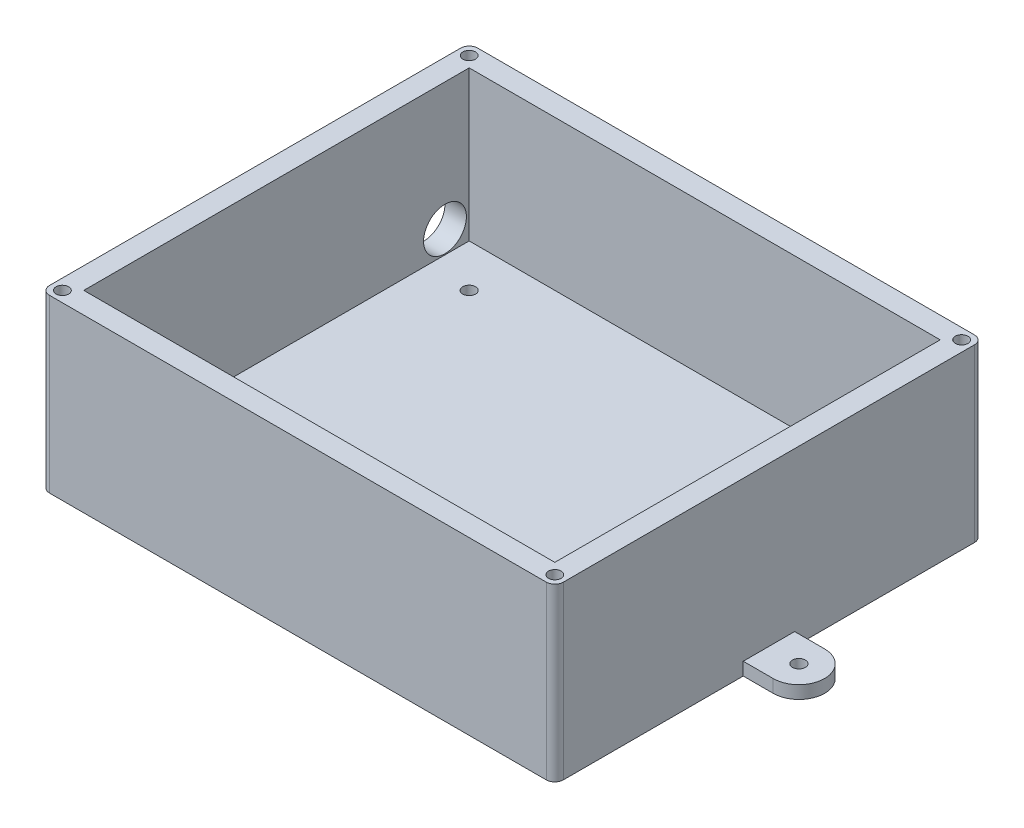
from build123d import *

# Parameters (mm, degrees)
SKETCH1_W               = 120
SKETCH1_H               = 100
BOSS_EXTRUDE1_DEPTH     = 40
SHELL1_T                = -5
SKETCH2_R               = 1.5
CUT_EXTRUDE1_DEPTH      = 86.586213843
SKETCH4_R               = 1.5
BOSS_EXTRUDE2_DEPTH     = 3
SKETCH7_R               = 5
CUT_EXTRUDE2_DEPTH      = 5
SKETCH8_R               = 1.475
CUT_EXTRUDE3_DEPTH      = 10
MIRROR2_COPY_1_SKETCH_R = 1.475
MIRROR2_COPY_1_DEPTH    = 10
FILLET1_R               = 2


with BuildPart() as part:
    # Sketch1 → Boss-Extrude1 (new body)
    with BuildSketch(Plane(origin=(0, 0, 0), x_dir=(1, 0, 0), z_dir=(0, 1, 0))):
        Rectangle(SKETCH1_W, SKETCH1_H)
    extrude(amount=BOSS_EXTRUDE1_DEPTH)

    # Shell1
    shell1_openings = [part.faces().sort_by_distance(p)[0] for p in [
        (0, 40, 0),
    ]]
    offset(amount=SHELL1_T, openings=shell1_openings, kind=Kind.INTERSECTION)

    # Sketch2 → Cut-Extrude1 (cut, through all)
    with BuildSketch(Plane(origin=(0, 5, 0), x_dir=(1, 0, 0), z_dir=(0, 1, 0))):
        with Locations(Location((-45, 35, 0), (0, 0, 270))):
            Circle(SKETCH2_R)
        with Locations(Location((45, 35, 0), (0, 0, 90))):
            Circle(SKETCH2_R)
        with Locations(Location((45, -35, 0), (0, 0, 270))):
            Circle(SKETCH2_R)
        with Locations(Location((-45, -35, 0), (0, 0, 90))):
            Circle(SKETCH2_R)
    extrude(amount=-CUT_EXTRUDE1_DEPTH, mode=Mode.SUBTRACT)

    # Sketch4 → Boss-Extrude2 (add)
    # profile 1 of 2: a face of its own
    with BuildSketch(Plane.XZ):
        with BuildLine():
            Line((60, 6), (67, 6))
            ThreePointArc((67, 6), (73, 0), (67, -6))
            Line((67, -6), (60, -6))
            Line((60, -6), (60, 6))
        make_face()
        with Locations(Location((67, 0, 0), (0, 0, 270))):
            Circle(SKETCH4_R, mode=Mode.SUBTRACT)
    # profile 2 of 2: a face of its own
    with BuildSketch(Plane.XZ):
        with BuildLine():
            Line((-60, 6), (-60, -6))
            Line((-60, -6), (-67, -6))
            ThreePointArc((-67, -6), (-73, 0), (-67, 6))
            Line((-67, 6), (-60, 6))
        make_face()
        with Locations(Location((-67, 0, 0), (0, 0, 90))):
            Circle(SKETCH4_R, mode=Mode.SUBTRACT)
    extrude(amount=-BOSS_EXTRUDE2_DEPTH)

    # Sketch7 → Cut-Extrude2 (cut)
    with BuildSketch(Plane.ZY.offset(60)):
        with Locations((-39.349087079, 10.249467904)):
            Circle(SKETCH7_R)
    extrude(amount=-CUT_EXTRUDE2_DEPTH, mode=Mode.SUBTRACT)

    # Sketch8 → Cut-Extrude3 (cut)
    with BuildSketch(Plane(origin=(0, 40, 0), x_dir=(1, 0, 0), z_dir=(0, 1, 0))):
        with Locations(Location((-57.5, 47.5, 0), (0, 0, 270))):
            Circle(SKETCH8_R)
    cut_extrude3 = extrude(amount=-CUT_EXTRUDE3_DEPTH, mode=Mode.SUBTRACT)

    # Mirror1: Cut-Extrude3 across plane
    add(cut_extrude3.mirror(Plane(origin=(0, 0, 0), x_dir=(0, 0, 1), z_dir=(1, 0, 0))), mode=Mode.SUBTRACT)

    # Mirror2: Cut-Extrude3 across plane
    add(cut_extrude3.mirror(Plane.XY), mode=Mode.SUBTRACT)

    # Mirror2 copy 1 sketch → Mirror2 copy 1 (cut)
    with BuildSketch(Plane(origin=(0, 40, 0), x_dir=(-1, 0, 0), z_dir=(0, 1, 0))):
        with Locations(Location((-57.5, 47.5, 0), (0, 0, 270))):
            Circle(MIRROR2_COPY_1_SKETCH_R)
    extrude(amount=-MIRROR2_COPY_1_DEPTH, mode=Mode.SUBTRACT)

    # Fillet1
    fillet1_edges = [part.edges().sort_by_distance(p)[0] for p in [
        (60, 20, 50),
        (-60, 20, 50),
        (-60, 20, -50),
        (60, 20, -50),
    ]]
    fillet(fillet1_edges, radius=FILLET1_R)


solid = part.part
